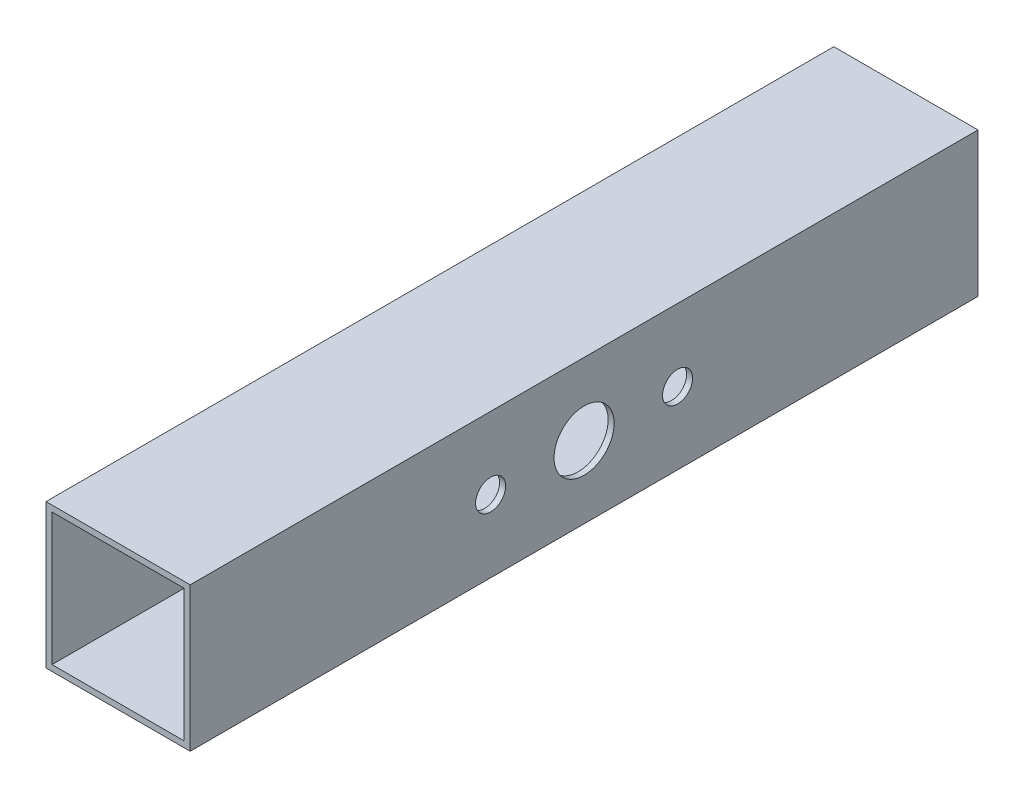
from build123d import *

# Parameters (mm, degrees)
SKETCH2_W           = 76.2
SKETCH2_H           = 76.2
SKETCH2_W_2         = 69.85
SKETCH2_H_2         = 69.85
BOSS_EXTRUDE1_DEPTH = 208.2
SKETCH3_R           = 15.875
SKETCH3_R_2         = 7.9375
CUT_EXTRUDE1_DEPTH  = 225.956195736


with BuildPart() as part:
    # Sketch2 → Boss-Extrude1 (new, symmetric)
    with BuildSketch(Plane.XY):
        Rectangle(SKETCH2_W, SKETCH2_H)
        Rectangle(SKETCH2_W_2, SKETCH2_H_2, mode=Mode.SUBTRACT)
    extrude(amount=BOSS_EXTRUDE1_DEPTH, both=True)

    # Sketch3 → Cut-Extrude1 (cut, through all)
    with BuildSketch(Plane.ZY.offset(38.1)):
        with Locations(Location((0, 0, 0), (0, 0, 270))):
            Circle(SKETCH3_R)
        with Locations(Location((-49.4109375, 0, 0), (0, 0, 270))):
            Circle(SKETCH3_R_2)
        with Locations(Location((49.4109375, 0, 0), (0, 0, 270))):
            Circle(SKETCH3_R_2)
    extrude(amount=-CUT_EXTRUDE1_DEPTH, mode=Mode.SUBTRACT)


solid = part.part
